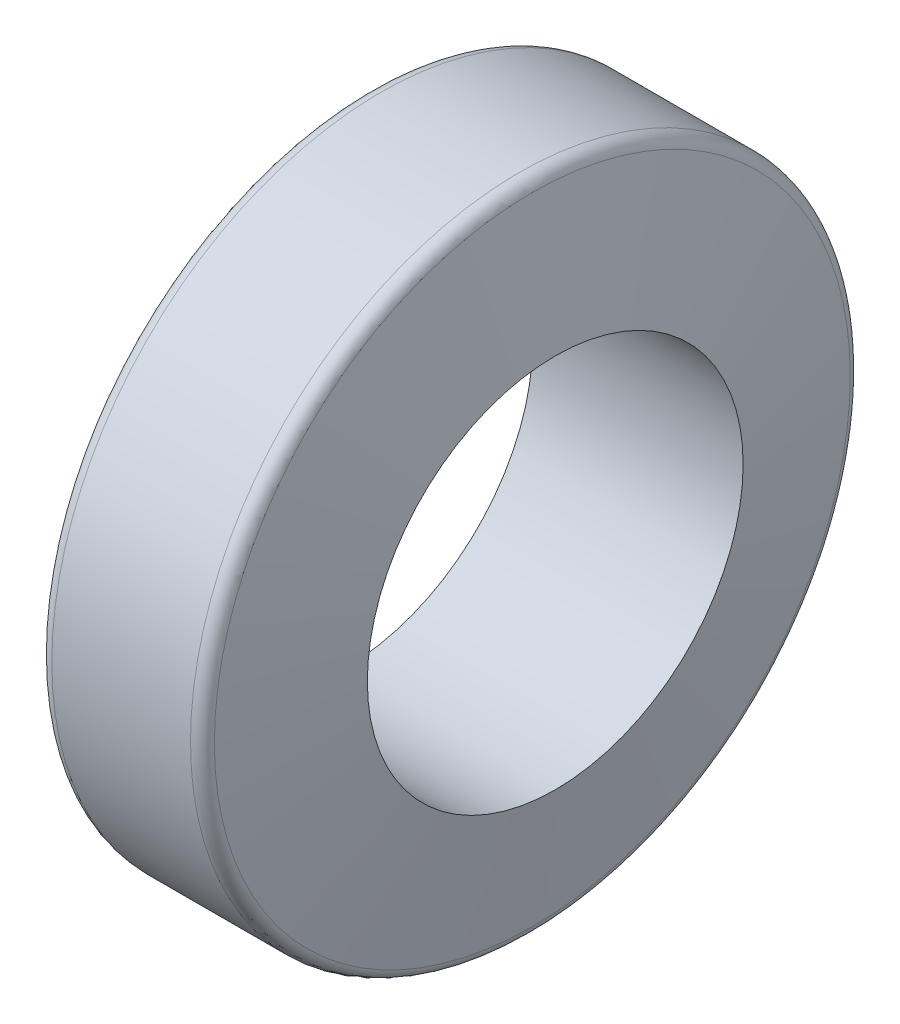
from build123d import *


with BuildPart() as part:
    # 草图1 → 旋转1 (revolve)
    with BuildSketch(Plane.XY, mode=Mode.PRIVATE) as revolve_1_sk:
        with BuildLine():
            Line((-16, 28.571428571), (16, 28.571428571))
            Line((16, 28.571428571), (12.512980943, 48.347296355))
            ThreePointArc((12.512980943, 48.347296355), (11.828940656, 49.532088886), (10.543365437, 50))
            Line((10.543365437, 50), (-10.543365437, 50))
            ThreePointArc((-10.543365437, 50), (-11.828940656, 49.532088886), (-12.512980943, 48.347296355))
            Line((-12.512980943, 48.347296355), (-16, 28.571428571))
        make_face()
    revolve(revolve_1_sk.sketch.rotate(Axis((50, 0, 0), (-1, 0, 0)), 270), axis=Axis((50, 0, 0), (-1, 0, 0)))


solid = part.part
